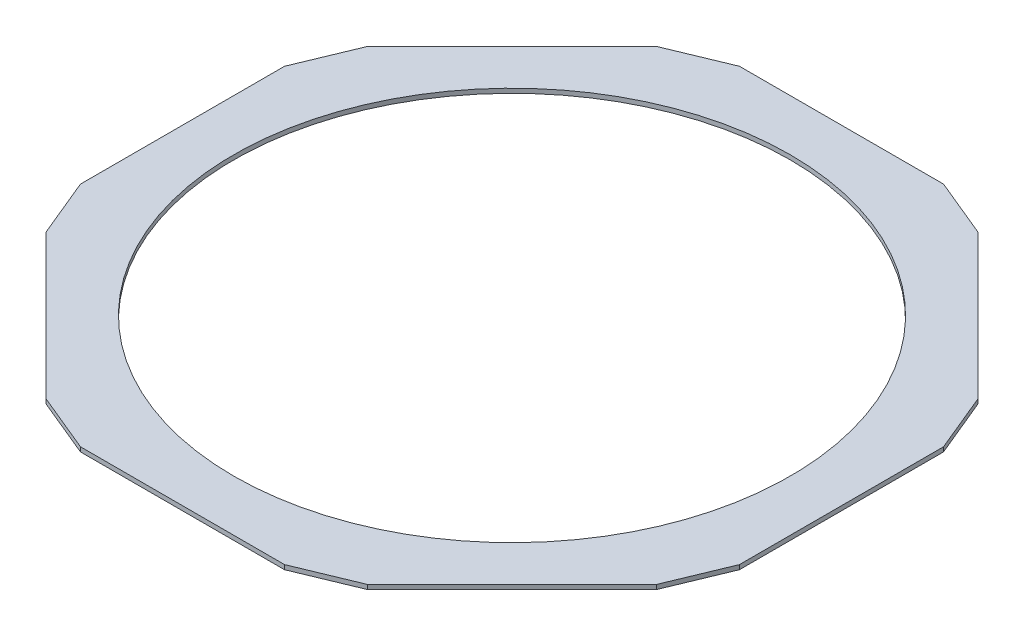
from build123d import *

# Parameters (mm, degrees)
SKETCH1_R           = 15
BOSS_EXTRUDE1_DEPTH = 0.24


with BuildPart() as part:
    # Sketch1 → Boss-Extrude1 (new body)
    with BuildSketch(Plane(origin=(0, 0, 0), x_dir=(1, 0, 0), z_dir=(0, 1, 0))):
        Polygon((0, 0), (11, 0), (14.168906797, 1.312604173), (21.94708139, 9.090778766), (23.259685563, 12.259685563), (23.259685563, 23.259685563), (21.94708139, 26.428592359), (14.168906797, 34.206766952), (11, 35.519371125), (0, 35.519371125), (-3.168906797, 34.206766952), (-10.94708139, 26.428592359), (-12.259685563, 23.259685563), (-12.259685563, 12.259685563), (-10.94708139, 9.090778766), (-3.168906797, 1.312604173), align=None)
        with Locations(Location((5.5, 17.759685563, 0), (0, 0, 270))):
            Circle(SKETCH1_R, mode=Mode.SUBTRACT)
    extrude(amount=BOSS_EXTRUDE1_DEPTH)


solid = part.part
